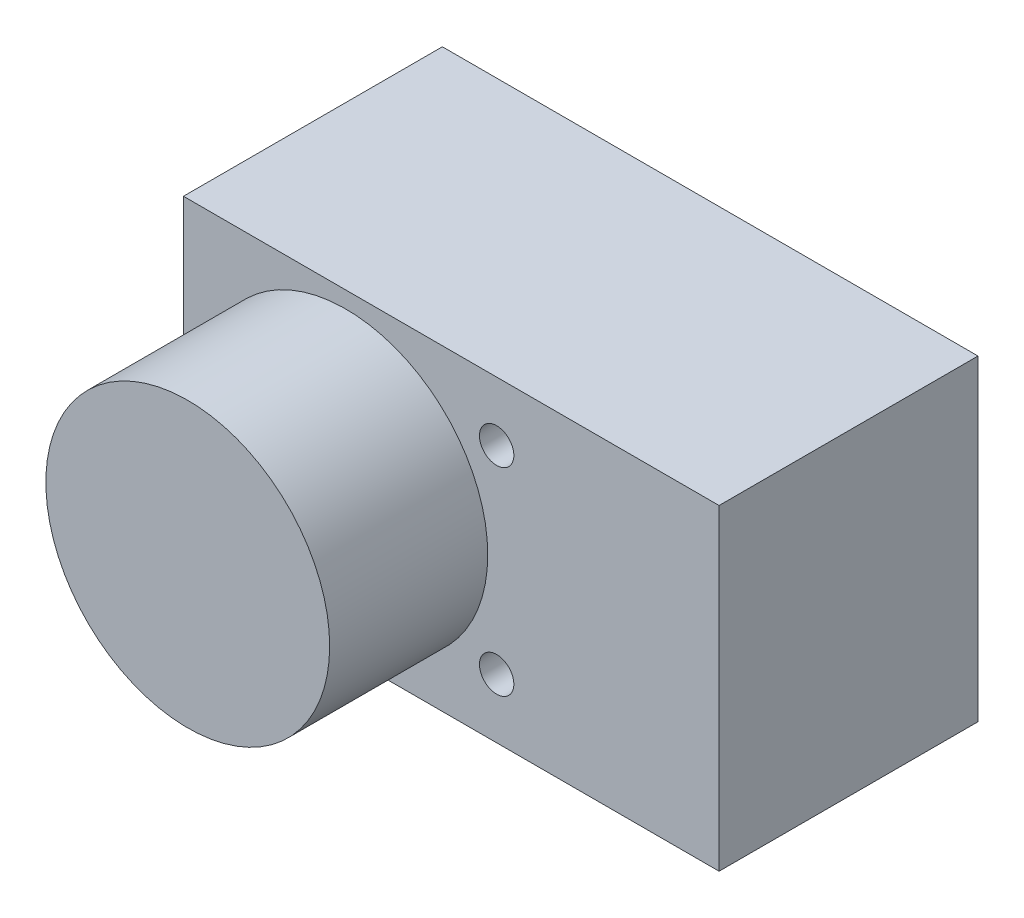
from build123d import *

# Parameters (mm, degrees)
SKETCH1_W                   = 45.8724
SKETCH1_H                   = 27.1272
BOSS_EXTRUDE1_DEPTH         = 22.1742
SKETCH2_R                   = 12.1539
BOSS_EXTRUDE2_DEPTH         = 13.5382
SKETCH3_R                   = 8.9662
BOSS_EXTRUDE3_DEPTH         = 1.2954
BOSS_EXTRUDE4_DEPTH         = 5.715
F_32_0_116_DIAMETER_HOLE1_D = 2.9464


with BuildPart() as part:
    # Sketch1 → Boss-Extrude1 (new body)
    with BuildSketch(Plane.XY):
        with Locations((22.9362, 13.5636)):
            Rectangle(SKETCH1_W, SKETCH1_H)
    extrude(amount=BOSS_EXTRUDE1_DEPTH)

    # Sketch2 → Boss-Extrude2 (add)
    with BuildSketch(Plane.XY.offset(22.1742)):
        with Locations((13.9065, 13.5636)):
            Circle(SKETCH2_R)
    extrude(amount=BOSS_EXTRUDE2_DEPTH)

    # Sketch3 → Boss-Extrude3 (add)
    with BuildSketch(Plane(origin=(0, 0, 0), x_dir=(-1, 0, 0), z_dir=(0, 0, -1))):
        with Locations((-11.2522, 13.5636)):
            Circle(SKETCH3_R)
    extrude(amount=BOSS_EXTRUDE3_DEPTH)

    # Sketch4 → Boss-Extrude4 (add)
    with BuildSketch(Plane(origin=(0, 0, -1.2954), x_dir=(-1, 0, 0), z_dir=(0, 0, -1))):
        with BuildLine():
            Line((-8.713438552, 15.8496), (-13.790961448, 15.8496))
            ThreePointArc((-13.790961448, 15.8496), (-14.6685, 13.5636), (-13.790961448, 11.2776))
            Line((-13.790961448, 11.2776), (-8.713438552, 11.2776))
            ThreePointArc((-8.713438552, 11.2776), (-8.06282103, 12.339276727), (-7.8359, 13.5636))
            ThreePointArc((-7.8359, 13.5636), (-8.06282103, 14.787923273), (-8.713438552, 15.8496))
        make_face()
    extrude(amount=BOSS_EXTRUDE4_DEPTH)

    # #32 (0.116) Diameter Hole1 (through all)
    with Locations(Plane(origin=(0, 0, 0), x_dir=(-1, 0, 0), z_dir=(0, 0, -1))):
        with Locations((-26.8224, 22.0472), (-26.8224, 5.08)):
            Hole(F_32_0_116_DIAMETER_HOLE1_D / 2)


solid = part.part
